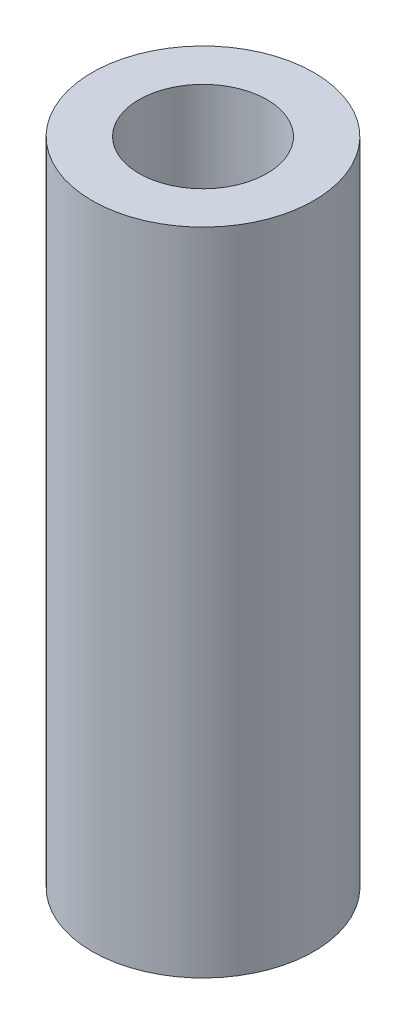
from build123d import *

# Parameters (mm, degrees)
SKETCH1_R           = 3.25
SKETCH1_R_2         = 1.875
BOSS_EXTRUDE1_DEPTH = 19.05


with BuildPart() as part:
    # Sketch1 → Boss-Extrude1 (new body)
    with BuildSketch(Plane(origin=(0, 0, 0), x_dir=(1, 0, 0), z_dir=(0, 1, 0))):
        with Locations(Location((0, 0, 0), (0, 0, 90))):
            Circle(SKETCH1_R)
        with Locations(Location((0, 0, 0), (0, 0, 90))):
            Circle(SKETCH1_R_2, mode=Mode.SUBTRACT)
    extrude(amount=BOSS_EXTRUDE1_DEPTH)


solid = part.part
